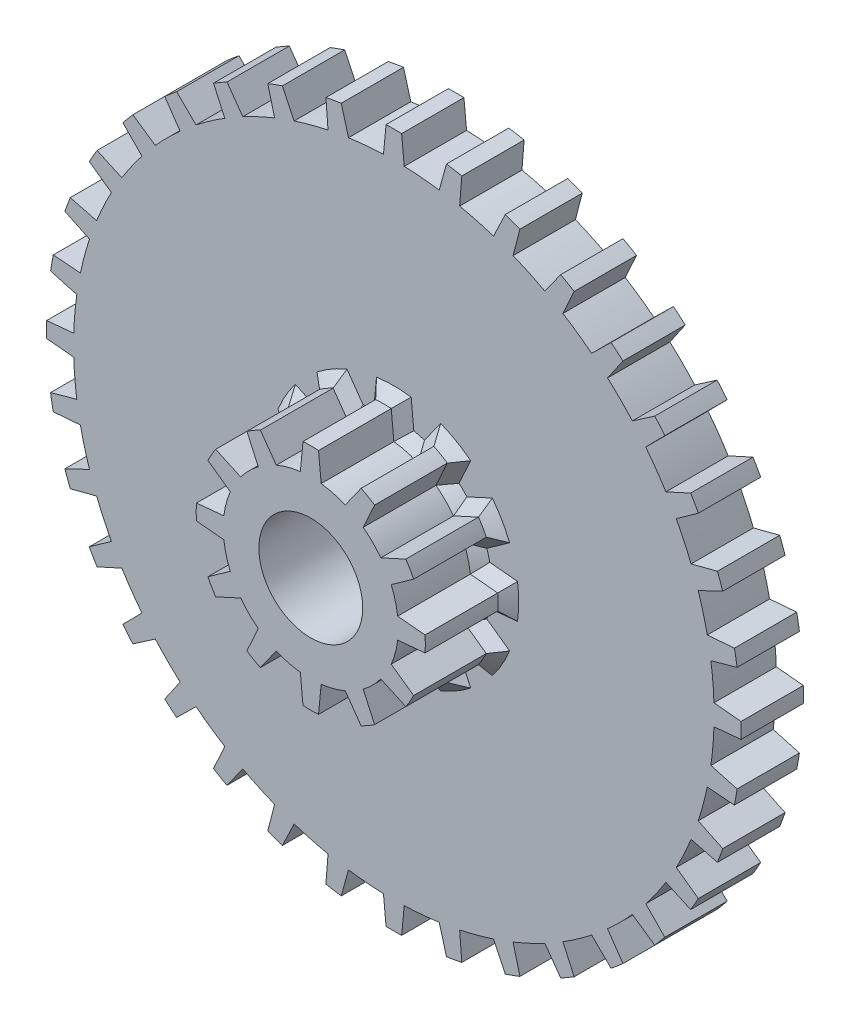
from build123d import *

# Parameters (mm, degrees)
CROQUIS1_R              = 2.5
SALIENTE_EXTRUIR1_DEPTH = 3
CROQUIS2_R              = 2.5
SALIENTE_EXTRUIR2_DEPTH = 4
CHAFL_N3_SIZE           = 0.5


with BuildPart() as part:
    # Croquis1 → Saliente-Extruir1 (new body)
    with BuildSketch(Plane.XY):
        with BuildLine():
            Line((-0.375, 16.714216942), (-0.5, 15.410313844))
            ThreePointArc((-0.5, 15.410313844), (-1.343804123, 15.359751406), (-2.18356904, 15.263020639))
            Line((-2.18356904, 15.263020639), (-2.533090406, 16.525408497))
            ThreePointArc((-2.533090406, 16.525408497), (-2.903123715, 16.464432747), (-3.271696221, 16.395172363))
            Line((-3.271696221, 16.395172363), (-3.168376793, 15.089372461))
            ThreePointArc((-3.168376793, 15.089372461), (-3.99058156, 14.893053132), (-4.800791439, 14.651968275))
            Line((-4.800791439, 14.651968275), (-5.364214141, 15.834483876))
            ThreePointArc((-5.364214141, 15.834483876), (-5.718037486, 15.710178876), (-6.068983607, 15.577968769))
            Line((-6.068983607, 15.577968769), (-5.74048406, 14.309948132))
            ThreePointArc((-5.74048406, 14.309948132), (-6.516107195, 13.973836975), (-7.27214422, 13.595723269))
            Line((-7.27214422, 13.595723269), (-8.032348945, 14.662436476))
            ThreePointArc((-8.032348945, 14.662436476), (-8.35921158, 14.478579169), (-8.681867997, 14.287436476))
            Line((-8.681867997, 14.287436476), (-8.138169624, 13.095723269))
            ThreePointArc((-8.138169624, 13.095723269), (-8.843644211, 12.630032852), (-9.522536579, 12.126379092))
            Line((-9.522536579, 12.126379092), (-10.45642489, 13.044878363))
            ThreePointArc((-10.45642489, 13.044878363), (-10.746395261, 12.80705516), (-11.030958222, 12.562787656))
            Line((-11.030958222, 12.562787656), (-10.288581022, 11.483591482))
            ThreePointArc((-10.288581022, 11.483591482), (-10.902471572, 10.902471572), (-11.483591482, 10.288581022))
            Line((-11.483591482, 10.288581022), (-12.562787656, 11.030958222))
            ThreePointArc((-12.562787656, 11.030958222), (-12.80705516, 10.746395261), (-13.044878363, 10.45642489))
            Line((-13.044878363, 10.45642489), (-12.126379092, 9.522536579))
            ThreePointArc((-12.126379092, 9.522536579), (-12.630032852, 8.843644211), (-13.095723269, 8.138169624))
            Line((-13.095723269, 8.138169624), (-14.287436476, 8.681867997))
            ThreePointArc((-14.287436476, 8.681867997), (-14.478579169, 8.35921158), (-14.662436476, 8.032348945))
            Line((-14.662436476, 8.032348945), (-13.595723269, 7.27214422))
            ThreePointArc((-13.595723269, 7.27214422), (-13.973836975, 6.516107195), (-14.309948132, 5.74048406))
            Line((-14.309948132, 5.74048406), (-15.577968769, 6.068983607))
            ThreePointArc((-15.577968769, 6.068983607), (-15.710178876, 5.718037486), (-15.834483876, 5.364214141))
            Line((-15.834483876, 5.364214141), (-14.651968275, 4.800791439))
            ThreePointArc((-14.651968275, 4.800791439), (-14.893053132, 3.99058156), (-15.089372461, 3.168376793))
            Line((-15.089372461, 3.168376793), (-16.395172363, 3.271696221))
            ThreePointArc((-16.395172363, 3.271696221), (-16.464432747, 2.903123715), (-16.525408497, 2.533090406))
            Line((-16.525408497, 2.533090406), (-15.263020639, 2.18356904))
            ThreePointArc((-15.263020639, 2.18356904), (-15.359751406, 1.343804123), (-15.410313844, 0.5))
            Line((-15.410313844, 0.5), (-16.714216942, 0.375))
            ThreePointArc((-16.714216942, 0.375), (-16.718423161, 0), (-16.714216942, -0.375))
            Line((-16.714216942, -0.375), (-15.410313844, -0.5))
            ThreePointArc((-15.410313844, -0.5), (-15.359751406, -1.343804123), (-15.263020639, -2.18356904))
            Line((-15.263020639, -2.18356904), (-16.525408497, -2.533090406))
            ThreePointArc((-16.525408497, -2.533090406), (-16.464432747, -2.903123715), (-16.395172363, -3.271696221))
            Line((-16.395172363, -3.271696221), (-15.089372461, -3.168376793))
            ThreePointArc((-15.089372461, -3.168376793), (-14.893053132, -3.99058156), (-14.651968275, -4.800791439))
            Line((-14.651968275, -4.800791439), (-15.834483876, -5.364214141))
            ThreePointArc((-15.834483876, -5.364214141), (-15.710178876, -5.718037486), (-15.577968769, -6.068983607))
            Line((-15.577968769, -6.068983607), (-14.309948132, -5.74048406))
            ThreePointArc((-14.309948132, -5.74048406), (-13.973836975, -6.516107195), (-13.595723269, -7.27214422))
            Line((-13.595723269, -7.27214422), (-14.662436476, -8.032348945))
            ThreePointArc((-14.662436476, -8.032348945), (-14.478579169, -8.35921158), (-14.287436476, -8.681867997))
            Line((-14.287436476, -8.681867997), (-13.095723269, -8.138169624))
            ThreePointArc((-13.095723269, -8.138169624), (-12.630032852, -8.843644211), (-12.126379092, -9.522536579))
            Line((-12.126379092, -9.522536579), (-13.044878363, -10.45642489))
            ThreePointArc((-13.044878363, -10.45642489), (-12.80705516, -10.746395261), (-12.562787656, -11.030958222))
            Line((-12.562787656, -11.030958222), (-11.483591482, -10.288581022))
            ThreePointArc((-11.483591482, -10.288581022), (-10.902471572, -10.902471572), (-10.288581022, -11.483591482))
            Line((-10.288581022, -11.483591482), (-11.030958222, -12.562787656))
            ThreePointArc((-11.030958222, -12.562787656), (-10.746395261, -12.80705516), (-10.45642489, -13.044878363))
            Line((-10.45642489, -13.044878363), (-9.522536579, -12.126379092))
            ThreePointArc((-9.522536579, -12.126379092), (-8.843644211, -12.630032852), (-8.138169624, -13.095723269))
            Line((-8.138169624, -13.095723269), (-8.681867997, -14.287436476))
            ThreePointArc((-8.681867997, -14.287436476), (-8.35921158, -14.478579169), (-8.032348945, -14.662436476))
            Line((-8.032348945, -14.662436476), (-7.27214422, -13.595723269))
            ThreePointArc((-7.27214422, -13.595723269), (-6.516107195, -13.973836975), (-5.74048406, -14.309948132))
            Line((-5.74048406, -14.309948132), (-6.068983607, -15.577968769))
            ThreePointArc((-6.068983607, -15.577968769), (-5.718037486, -15.710178876), (-5.364214141, -15.834483876))
            Line((-5.364214141, -15.834483876), (-4.800791439, -14.651968275))
            ThreePointArc((-4.800791439, -14.651968275), (-3.99058156, -14.893053132), (-3.168376793, -15.089372461))
            Line((-3.168376793, -15.089372461), (-3.271696221, -16.395172363))
            ThreePointArc((-3.271696221, -16.395172363), (-2.903123715, -16.464432747), (-2.533090406, -16.525408497))
            Line((-2.533090406, -16.525408497), (-2.18356904, -15.263020639))
            ThreePointArc((-2.18356904, -15.263020639), (-1.343804123, -15.359751406), (-0.5, -15.410313844))
            Line((-0.5, -15.410313844), (-0.375, -16.714216942))
            ThreePointArc((-0.375, -16.714216942), (0, -16.718423161), (0.375, -16.714216942))
            Line((0.375, -16.714216942), (0.5, -15.410313844))
            ThreePointArc((0.5, -15.410313844), (1.343804123, -15.359751406), (2.18356904, -15.263020639))
            Line((2.18356904, -15.263020639), (2.533090406, -16.525408497))
            ThreePointArc((2.533090406, -16.525408497), (2.903123715, -16.464432747), (3.271696221, -16.395172363))
            Line((3.271696221, -16.395172363), (3.168376793, -15.089372461))
            ThreePointArc((3.168376793, -15.089372461), (3.99058156, -14.893053132), (4.800791439, -14.651968275))
            Line((4.800791439, -14.651968275), (5.364214141, -15.834483876))
            ThreePointArc((5.364214141, -15.834483876), (5.718037486, -15.710178876), (6.068983607, -15.577968769))
            Line((6.068983607, -15.577968769), (5.74048406, -14.309948132))
            ThreePointArc((5.74048406, -14.309948132), (6.516107195, -13.973836975), (7.27214422, -13.595723269))
            Line((7.27214422, -13.595723269), (8.032348945, -14.662436476))
            ThreePointArc((8.032348945, -14.662436476), (8.35921158, -14.478579169), (8.681867997, -14.287436476))
            Line((8.681867997, -14.287436476), (8.138169624, -13.095723269))
            ThreePointArc((8.138169624, -13.095723269), (8.843644211, -12.630032852), (9.522536579, -12.126379092))
            Line((9.522536579, -12.126379092), (10.45642489, -13.044878363))
            ThreePointArc((10.45642489, -13.044878363), (10.746395261, -12.80705516), (11.030958222, -12.562787656))
            Line((11.030958222, -12.562787656), (10.288581022, -11.483591482))
            ThreePointArc((10.288581022, -11.483591482), (10.902471572, -10.902471572), (11.483591482, -10.288581022))
            Line((11.483591482, -10.288581022), (12.562787656, -11.030958222))
            ThreePointArc((12.562787656, -11.030958222), (12.80705516, -10.746395261), (13.044878363, -10.45642489))
            Line((13.044878363, -10.45642489), (12.126379092, -9.522536579))
            ThreePointArc((12.126379092, -9.522536579), (12.630032852, -8.843644211), (13.095723269, -8.138169624))
            Line((13.095723269, -8.138169624), (14.287436476, -8.681867997))
            ThreePointArc((14.287436476, -8.681867997), (14.478579169, -8.35921158), (14.662436476, -8.032348945))
            Line((14.662436476, -8.032348945), (13.595723269, -7.27214422))
            ThreePointArc((13.595723269, -7.27214422), (13.973836975, -6.516107195), (14.309948132, -5.74048406))
            Line((14.309948132, -5.74048406), (15.577968769, -6.068983607))
            ThreePointArc((15.577968769, -6.068983607), (15.710178876, -5.718037486), (15.834483876, -5.364214141))
            Line((15.834483876, -5.364214141), (14.651968275, -4.800791439))
            ThreePointArc((14.651968275, -4.800791439), (14.893053132, -3.99058156), (15.089372461, -3.168376793))
            Line((15.089372461, -3.168376793), (16.395172363, -3.271696221))
            ThreePointArc((16.395172363, -3.271696221), (16.464432747, -2.903123715), (16.525408497, -2.533090406))
            Line((16.525408497, -2.533090406), (15.263020639, -2.18356904))
            ThreePointArc((15.263020639, -2.18356904), (15.359751406, -1.343804123), (15.410313844, -0.5))
            Line((15.410313844, -0.5), (16.714216942, -0.375))
            ThreePointArc((16.714216942, -0.375), (16.718423161, 0), (16.714216942, 0.375))
            Line((16.714216942, 0.375), (15.410313844, 0.5))
            ThreePointArc((15.410313844, 0.5), (15.359751406, 1.343804123), (15.263020639, 2.18356904))
            Line((15.263020639, 2.18356904), (16.525408497, 2.533090406))
            ThreePointArc((16.525408497, 2.533090406), (16.464432747, 2.903123715), (16.395172363, 3.271696221))
            Line((16.395172363, 3.271696221), (15.089372461, 3.168376793))
            ThreePointArc((15.089372461, 3.168376793), (14.893053132, 3.99058156), (14.651968275, 4.800791439))
            Line((14.651968275, 4.800791439), (15.834483876, 5.364214141))
            ThreePointArc((15.834483876, 5.364214141), (15.710178876, 5.718037486), (15.577968769, 6.068983607))
            Line((15.577968769, 6.068983607), (14.309948132, 5.74048406))
            ThreePointArc((14.309948132, 5.74048406), (13.973836975, 6.516107195), (13.595723269, 7.27214422))
            Line((13.595723269, 7.27214422), (14.662436476, 8.032348945))
            ThreePointArc((14.662436476, 8.032348945), (14.478579169, 8.35921158), (14.287436476, 8.681867997))
            Line((14.287436476, 8.681867997), (13.095723269, 8.138169624))
            ThreePointArc((13.095723269, 8.138169624), (12.630032852, 8.843644211), (12.126379092, 9.522536579))
            Line((12.126379092, 9.522536579), (13.044878363, 10.45642489))
            ThreePointArc((13.044878363, 10.45642489), (12.80705516, 10.746395261), (12.562787656, 11.030958222))
            Line((12.562787656, 11.030958222), (11.483591482, 10.288581022))
            ThreePointArc((11.483591482, 10.288581022), (10.902471572, 10.902471572), (10.288581022, 11.483591482))
            Line((10.288581022, 11.483591482), (11.030958222, 12.562787656))
            ThreePointArc((11.030958222, 12.562787656), (10.746395261, 12.80705516), (10.45642489, 13.044878363))
            Line((10.45642489, 13.044878363), (9.522536579, 12.126379092))
            ThreePointArc((9.522536579, 12.126379092), (8.843644211, 12.630032852), (8.138169624, 13.095723269))
            Line((8.138169624, 13.095723269), (8.681867997, 14.287436476))
            ThreePointArc((8.681867997, 14.287436476), (8.35921158, 14.478579169), (8.032348945, 14.662436476))
            Line((8.032348945, 14.662436476), (7.27214422, 13.595723269))
            ThreePointArc((7.27214422, 13.595723269), (6.516107195, 13.973836975), (5.74048406, 14.309948132))
            Line((5.74048406, 14.309948132), (6.068983607, 15.577968769))
            ThreePointArc((6.068983607, 15.577968769), (5.718037486, 15.710178876), (5.364214141, 15.834483876))
            Line((5.364214141, 15.834483876), (4.800791439, 14.651968275))
            ThreePointArc((4.800791439, 14.651968275), (3.99058156, 14.893053132), (3.168376793, 15.089372461))
            Line((3.168376793, 15.089372461), (3.271696221, 16.395172363))
            ThreePointArc((3.271696221, 16.395172363), (2.903123715, 16.464432747), (2.533090406, 16.525408497))
            Line((2.533090406, 16.525408497), (2.18356904, 15.263020639))
            ThreePointArc((2.18356904, 15.263020639), (1.343804123, 15.359751406), (0.5, 15.410313844))
            Line((0.5, 15.410313844), (0.375, 16.714216942))
            ThreePointArc((0.375, 16.714216942), (0, 16.718423161), (-0.375, 16.714216942))
        make_face()
        Circle(CROQUIS1_R, mode=Mode.SUBTRACT)
    extrude(amount=SALIENTE_EXTRUIR1_DEPTH)

    # Croquis2 → Saliente-Extruir2 (add)
    with BuildSketch(Plane.XY.offset(3)):
        with BuildLine():
            Line((-0.375, 5.501249073), (-0.5, 4.184247387))
            ThreePointArc((-0.5, 4.184247387), (-1.090667454, 4.070426353), (-1.659110992, 3.873664533))
            Line((-1.659110992, 3.873664533), (-2.42586501, 4.951721449))
            ThreePointArc((-2.42586501, 4.951721449), (-2.757007724, 4.775277455), (-3.075384063, 4.576721449))
            Line((-3.075384063, 4.576721449), (-2.525136395, 3.373664533))
            ThreePointArc((-2.525136395, 3.373664533), (-2.979758899, 2.979758899), (-3.373664533, 2.525136395))
            Line((-3.373664533, 2.525136395), (-4.576721449, 3.075384063))
            ThreePointArc((-4.576721449, 3.075384063), (-4.775277455, 2.757007724), (-4.951721449, 2.42586501))
            Line((-4.951721449, 2.42586501), (-3.873664533, 1.659110992))
            ThreePointArc((-3.873664533, 1.659110992), (-4.070426353, 1.090667454), (-4.184247387, 0.5))
            Line((-4.184247387, 0.5), (-5.501249073, 0.375))
            ThreePointArc((-5.501249073, 0.375), (-5.514015448, 0), (-5.501249073, -0.375))
            Line((-5.501249073, -0.375), (-4.184247387, -0.5))
            ThreePointArc((-4.184247387, -0.5), (-4.070426353, -1.090667454), (-3.873664533, -1.659110992))
            Line((-3.873664533, -1.659110992), (-4.951721449, -2.42586501))
            ThreePointArc((-4.951721449, -2.42586501), (-4.775277455, -2.757007724), (-4.576721449, -3.075384063))
            Line((-4.576721449, -3.075384063), (-3.373664533, -2.525136395))
            ThreePointArc((-3.373664533, -2.525136395), (-2.979758899, -2.979758899), (-2.525136395, -3.373664533))
            Line((-2.525136395, -3.373664533), (-3.075384063, -4.576721449))
            ThreePointArc((-3.075384063, -4.576721449), (-2.757007724, -4.775277455), (-2.42586501, -4.951721449))
            Line((-2.42586501, -4.951721449), (-1.659110992, -3.873664533))
            ThreePointArc((-1.659110992, -3.873664533), (-1.090667454, -4.070426353), (-0.5, -4.184247387))
            Line((-0.5, -4.184247387), (-0.375, -5.501249073))
            ThreePointArc((-0.375, -5.501249073), (0, -5.514015448), (0.375, -5.501249073))
            Line((0.375, -5.501249073), (0.5, -4.184247387))
            ThreePointArc((0.5, -4.184247387), (1.090667454, -4.070426353), (1.659110992, -3.873664533))
            Line((1.659110992, -3.873664533), (2.42586501, -4.951721449))
            ThreePointArc((2.42586501, -4.951721449), (2.757007724, -4.775277455), (3.075384063, -4.576721449))
            Line((3.075384063, -4.576721449), (2.525136395, -3.373664533))
            ThreePointArc((2.525136395, -3.373664533), (2.979758899, -2.979758899), (3.373664533, -2.525136395))
            Line((3.373664533, -2.525136395), (4.576721449, -3.075384063))
            ThreePointArc((4.576721449, -3.075384063), (4.775277455, -2.757007724), (4.951721449, -2.42586501))
            Line((4.951721449, -2.42586501), (3.873664533, -1.659110992))
            ThreePointArc((3.873664533, -1.659110992), (4.070426353, -1.090667454), (4.184247387, -0.5))
            Line((4.184247387, -0.5), (5.501249073, -0.375))
            ThreePointArc((5.501249073, -0.375), (5.514015448, 0), (5.501249073, 0.375))
            Line((5.501249073, 0.375), (4.184247387, 0.5))
            ThreePointArc((4.184247387, 0.5), (4.070426353, 1.090667454), (3.873664533, 1.659110992))
            Line((3.873664533, 1.659110992), (4.951721449, 2.42586501))
            ThreePointArc((4.951721449, 2.42586501), (4.775277455, 2.757007724), (4.576721449, 3.075384063))
            Line((4.576721449, 3.075384063), (3.373664533, 2.525136395))
            ThreePointArc((3.373664533, 2.525136395), (2.979758899, 2.979758899), (2.525136395, 3.373664533))
            Line((2.525136395, 3.373664533), (3.075384063, 4.576721449))
            ThreePointArc((3.075384063, 4.576721449), (2.757007724, 4.775277455), (2.42586501, 4.951721449))
            Line((2.42586501, 4.951721449), (1.659110992, 3.873664533))
            ThreePointArc((1.659110992, 3.873664533), (1.090667454, 4.070426353), (0.5, 4.184247387))
            Line((0.5, 4.184247387), (0.375, 5.501249073))
            ThreePointArc((0.375, 5.501249073), (0, 5.514015448), (-0.375, 5.501249073))
        make_face()
        Circle(CROQUIS2_R, mode=Mode.SUBTRACT)
    extrude(amount=SALIENTE_EXTRUIR2_DEPTH)

    # Chaflán3
    chafl_n3_edges = [part.edges().sort_by_distance(p)[0] for p in [
        (0, 5.514015448, 3),
        (-0.4375, 4.84274823, 3),
        (-1.090667454, 4.070426353, 3),
        (-2.042488001, 4.412692991, 3),
        (-2.757007724, 4.775277455, 3),
        (-2.800260229, 3.975192991, 3),
        (-2.979758899, 2.979758899, 3),
        (-3.975192991, 2.800260229, 3),
        (-4.775277455, 2.757007724, 3),
        (-4.412692991, 2.042488001, 3),
        (-4.070426353, 1.090667454, 3),
        (-4.84274823, 0.4375, 3),
        (-5.514015448, 0, 3),
        (-4.84274823, -0.4375, 3),
        (-4.070426353, -1.090667454, 3),
        (-4.412692991, -2.042488001, 3),
        (-4.775277455, -2.757007724, 3),
        (-3.975192991, -2.800260229, 3),
        (-2.979758899, -2.979758899, 3),
        (-2.800260229, -3.975192991, 3),
        (-2.757007724, -4.775277455, 3),
        (-2.042488001, -4.412692991, 3),
        (-1.090667454, -4.070426353, 3),
        (-0.4375, -4.84274823, 3),
        (0, -5.514015448, 3),
        (0.4375, -4.84274823, 3),
        (1.090667454, -4.070426353, 3),
        (2.042488001, -4.412692991, 3),
        (2.757007724, -4.775277455, 3),
        (2.800260229, -3.975192991, 3),
        (2.979758899, -2.979758899, 3),
        (3.975192991, -2.800260229, 3),
        (4.775277455, -2.757007724, 3),
        (4.412692991, -2.042488001, 3),
        (4.070426353, -1.090667454, 3),
        (4.84274823, -0.4375, 3),
        (5.514015448, 0, 3),
        (4.84274823, 0.4375, 3),
        (4.070426353, 1.090667454, 3),
        (4.412692991, 2.042488001, 3),
        (4.775277455, 2.757007724, 3),
        (3.975192991, 2.800260229, 3),
        (2.979758899, 2.979758899, 3),
        (2.800260229, 3.975192991, 3),
        (2.757007724, 4.775277455, 3),
        (2.042488001, 4.412692991, 3),
        (1.090667454, 4.070426353, 3),
        (0.4375, 4.84274823, 3),
    ]]
    chamfer(chafl_n3_edges, length=CHAFL_N3_SIZE)


solid = part.part
